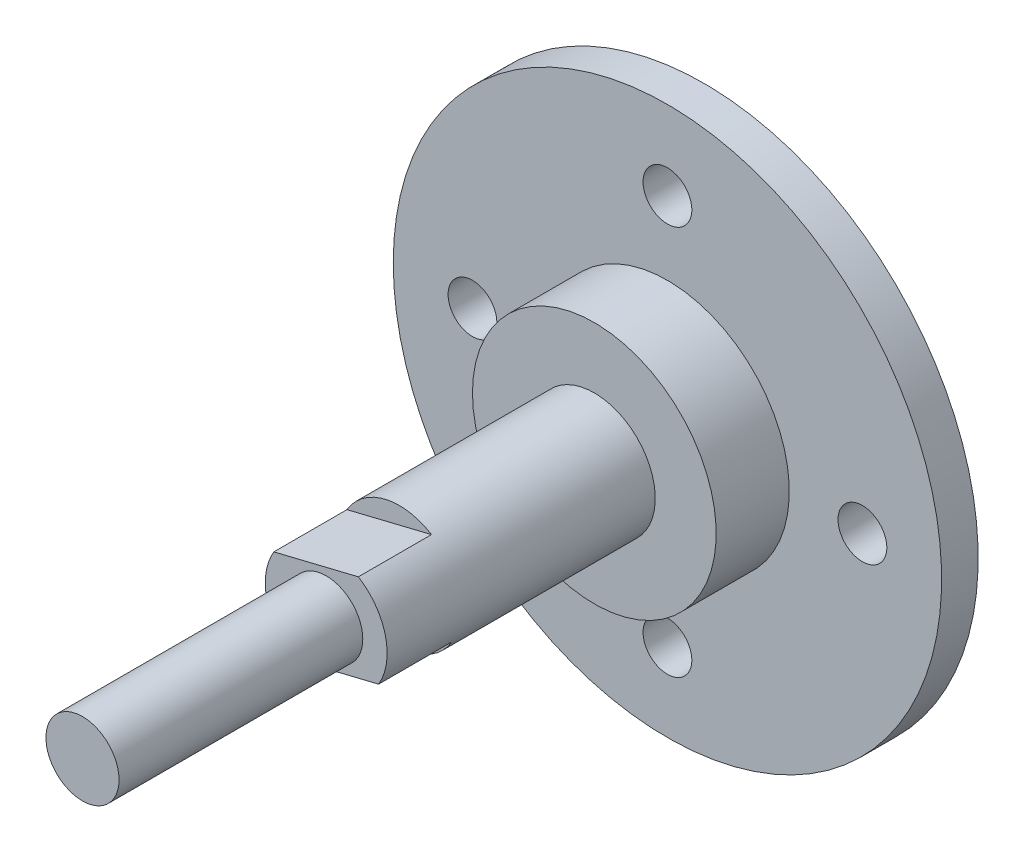
from build123d import *

# Parameters (mm, degrees)
SKETCH1_R           = 5
BOSS_EXTRUDE1_DEPTH = 22
CUT_EXTRUDE1_START  = -6
CUT_EXTRUDE1_DEPTH  = 6
SKETCH3_R           = 3
BOSS_EXTRUDE2_DEPTH = 20
SKETCH4_R           = 10
BOSS_EXTRUDE3_DEPTH = 6
SKETCH5_R           = 22.5
BOSS_EXTRUDE4_DEPTH = 3
SKETCH6_R           = 2
CUT_EXTRUDE2_DEPTH  = 3


with BuildPart() as part:
    # Sketch1 → Boss-Extrude1 (new body)
    with BuildSketch(Plane.XY):
        Circle(SKETCH1_R)
    extrude(amount=BOSS_EXTRUDE1_DEPTH)

    # Sketch2 → Cut-Extrude1 (cut)
    with BuildSketch(Plane.XY.offset(22).offset(CUT_EXTRUDE1_START)):
        with BuildLine():
            Line((2.638277831, 4.247292089), (-4.299208102, 2.552804281))
            ThreePointArc((-4.299208102, 2.552804281), (-1.186378765, 4.857211693), (2.638277831, 4.247292089))
        make_face()
        with BuildLine():
            Line((-2.638277831, -4.247292089), (4.299208102, -2.552804281))
            ThreePointArc((4.299208102, -2.552804281), (1.186378765, -4.857211693), (-2.638277831, -4.247292089))
        make_face()
    extrude(amount=CUT_EXTRUDE1_DEPTH, mode=Mode.SUBTRACT)

    # Sketch3 → Boss-Extrude2 (add)
    with BuildSketch(Plane.XY.offset(22)):
        Circle(SKETCH3_R)
    extrude(amount=BOSS_EXTRUDE2_DEPTH)

    # Sketch4 → Boss-Extrude3 (add)
    with BuildSketch(Plane(origin=(0, 0, 0), x_dir=(-1, 0, 0), z_dir=(0, 0, -1))):
        Circle(SKETCH4_R)
    extrude(amount=BOSS_EXTRUDE3_DEPTH)

    # Sketch5 → Boss-Extrude4 (add)
    with BuildSketch(Plane(origin=(0, 0, -6), x_dir=(-1, 0, 0), z_dir=(0, 0, -1))):
        Circle(SKETCH5_R)
    extrude(amount=BOSS_EXTRUDE4_DEPTH)

    # Sketch6 → Cut-Extrude2 (cut)
    with BuildSketch(Plane(origin=(0, 0, -9), x_dir=(-1, 0, 0), z_dir=(0, 0, -1))):
        with Locations((-16, 0)):
            Circle(SKETCH6_R)
        with Locations((0, 16)):
            Circle(SKETCH6_R)
        with Locations((16, 0)):
            Circle(SKETCH6_R)
        with Locations((0, -16)):
            Circle(SKETCH6_R)
    extrude(amount=-CUT_EXTRUDE2_DEPTH, mode=Mode.SUBTRACT)


solid = part.part
